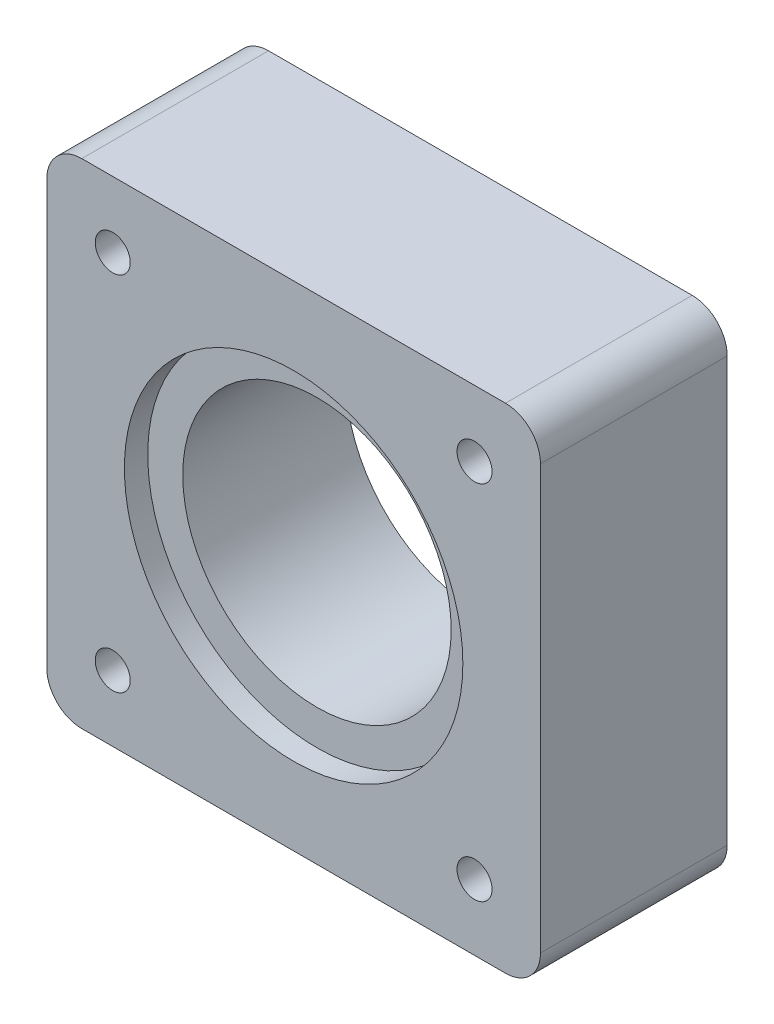
from build123d import *

# Parameters (mm, degrees)
ESQUISSE1_W             = 42.3
ESQUISSE1_H             = 42.3
BOSS_EXTRU_1_DEPTH      = 16
ESQUISSE2_R             = 1.5
ENL_V_MAT_EXTRU_2_DEPTH = 62.92398566
CONG_1_R                = 3
CONG_2_R                = 3
ESQUISSE4_R             = 11.5
ENL_V_MAT_EXTRU_4_DEPTH = 62.92398566
ESQUISSE5_R             = 2.85
ENL_V_MAT_EXTRU_5_DEPTH = 10
ESQUISSE6_R             = 4.25
ENL_V_MAT_EXTRU_6_DEPTH = 12
ESQUISSE7_R             = 14.5
ENL_V_MAT_EXTRU_7_DEPTH = 2


with BuildPart() as part:
    # Esquisse1 → Boss.-Extru.1 (new body)
    with BuildSketch(Plane.XY):
        with Locations((21.15, 21.15)):
            Rectangle(ESQUISSE1_W, ESQUISSE1_H)
    extrude(amount=BOSS_EXTRU_1_DEPTH)

    # Esquisse2 → Enlèv. mat.-Extru.2 (cut, through all)
    with BuildSketch(Plane.XY):
        with Locations((36.65, 36.65)):
            Circle(ESQUISSE2_R)
        with Locations((5.65, 36.65)):
            Circle(ESQUISSE2_R)
        with Locations((5.65, 5.65)):
            Circle(ESQUISSE2_R)
        with Locations((36.65, 5.65)):
            Circle(ESQUISSE2_R)
    extrude(amount=ENL_V_MAT_EXTRU_2_DEPTH, mode=Mode.SUBTRACT)

    # Congé1
    cong_1_edges = [part.edges().sort_by_distance(p)[0] for p in [
        (0, 42.3, 8),
        (42.3, 42.3, 8),
    ]]
    fillet(cong_1_edges, radius=CONG_1_R)

    # Congé2
    cong_2_edges = [part.edges().sort_by_distance(p)[0] for p in [
        (42.3, 0, 8),
        (0, 0, 8),
    ]]
    fillet(cong_2_edges, radius=CONG_2_R)

    # Esquisse4 → Enlèv. mat.-Extru.4 (cut, through all)
    with BuildSketch(Plane.XY):
        with Locations((21.15, 21.15)):
            Circle(ESQUISSE4_R)
    extrude(amount=ENL_V_MAT_EXTRU_4_DEPTH, mode=Mode.SUBTRACT)

    # Esquisse5 → Enlèv. mat.-Extru.5 (cut)
    with BuildSketch(Plane.XY):
        with Locations((36.65, 36.65)):
            Circle(ESQUISSE5_R)
        with Locations((5.65, 36.65)):
            Circle(ESQUISSE5_R)
        with Locations((5.65, 5.65)):
            Circle(ESQUISSE5_R)
        with Locations((36.65, 5.65)):
            Circle(ESQUISSE5_R)
    extrude(amount=ENL_V_MAT_EXTRU_5_DEPTH, mode=Mode.SUBTRACT)

    # Esquisse6 → Enlèv. mat.-Extru.6 (cut)
    with BuildSketch(Plane.XY):
        with Locations((29.3, 6.5)):
            Circle(ESQUISSE6_R)
        with Locations((13, 6.5)):
            Circle(ESQUISSE6_R)
    extrude(amount=ENL_V_MAT_EXTRU_6_DEPTH, mode=Mode.SUBTRACT)

    # Esquisse7 → Enlèv. mat.-Extru.7 (cut)
    with BuildSketch(Plane.XY.offset(16)):
        with Locations((21.15, 21.15)):
            Circle(ESQUISSE7_R)
    extrude(amount=-ENL_V_MAT_EXTRU_7_DEPTH, mode=Mode.SUBTRACT)


solid = part.part
